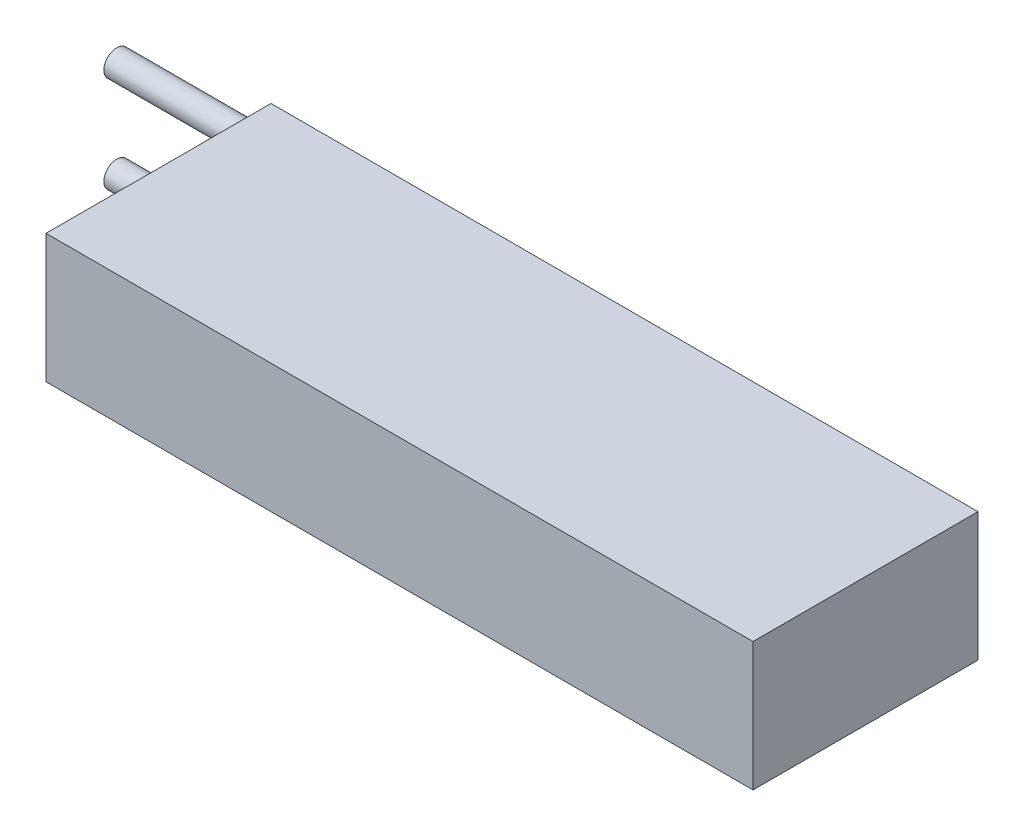
from build123d import *

# Parameters (mm, degrees)
SKETCH1_W           = 110
SKETCH1_H           = 35
BOSS_EXTRUDE1_DEPTH = 20
SKETCH2_R           = 2
BOSS_EXTRUDE2_DEPTH = 20


with BuildPart() as part:
    # Sketch1 → Boss-Extrude1 (new body)
    with BuildSketch(Plane(origin=(0, 0, 0), x_dir=(1, 0, 0), z_dir=(0, 1, 0))):
        with Locations((55, 17.5)):
            Rectangle(SKETCH1_W, SKETCH1_H)
    extrude(amount=BOSS_EXTRUDE1_DEPTH)

    # Sketch2 → Boss-Extrude2 (add)
    with BuildSketch(Plane.ZY):
        with Locations(Location((-31, 17.5, 0), (0, 0, 180))):
            Circle(SKETCH2_R)
        with Locations(Location((-31, 2.5, 0), (0, 0, 180))):
            Circle(SKETCH2_R)
    extrude(amount=BOSS_EXTRUDE2_DEPTH)


solid = part.part
